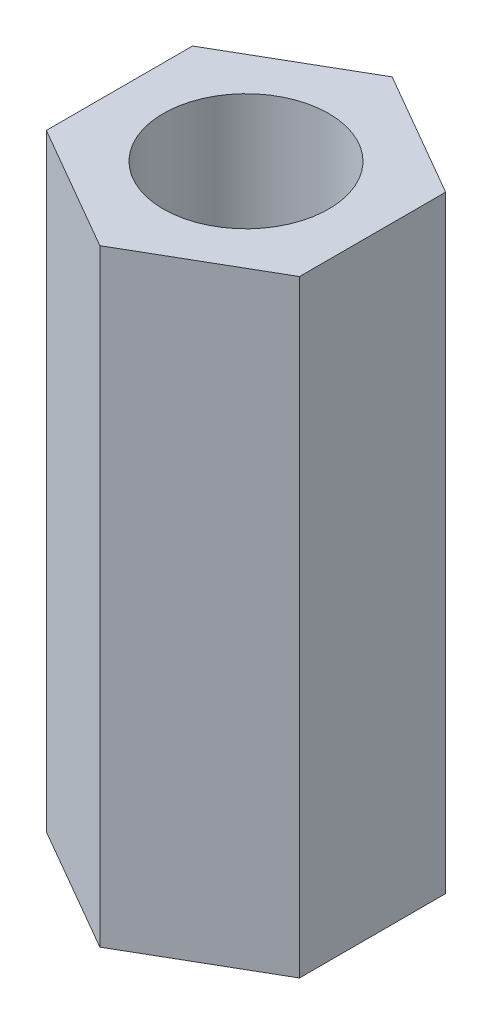
from build123d import *

# Parameters (mm, degrees)
SKETCH1_R           = 1.635
BOSS_EXTRUDE1_DEPTH = 12


with BuildPart() as part:
    # Sketch1 → Boss-Extrude1 (new body)
    with BuildSketch(Plane(origin=(0, 0, 0), x_dir=(1, 0, 0), z_dir=(0, 1, 0))):
        Polygon((2.500215268, 1.443500126), (2.500215413, -1.443499874), (1.45e-07, -2.887), (-2.500215268, -1.443500126), (-2.500215413, 1.443499874), (-1.45e-07, 2.887), align=None)
        with Locations(Location((0, 0, 0), (0, 0, 270))):
            Circle(SKETCH1_R, mode=Mode.SUBTRACT)
    extrude(amount=BOSS_EXTRUDE1_DEPTH)


solid = part.part
